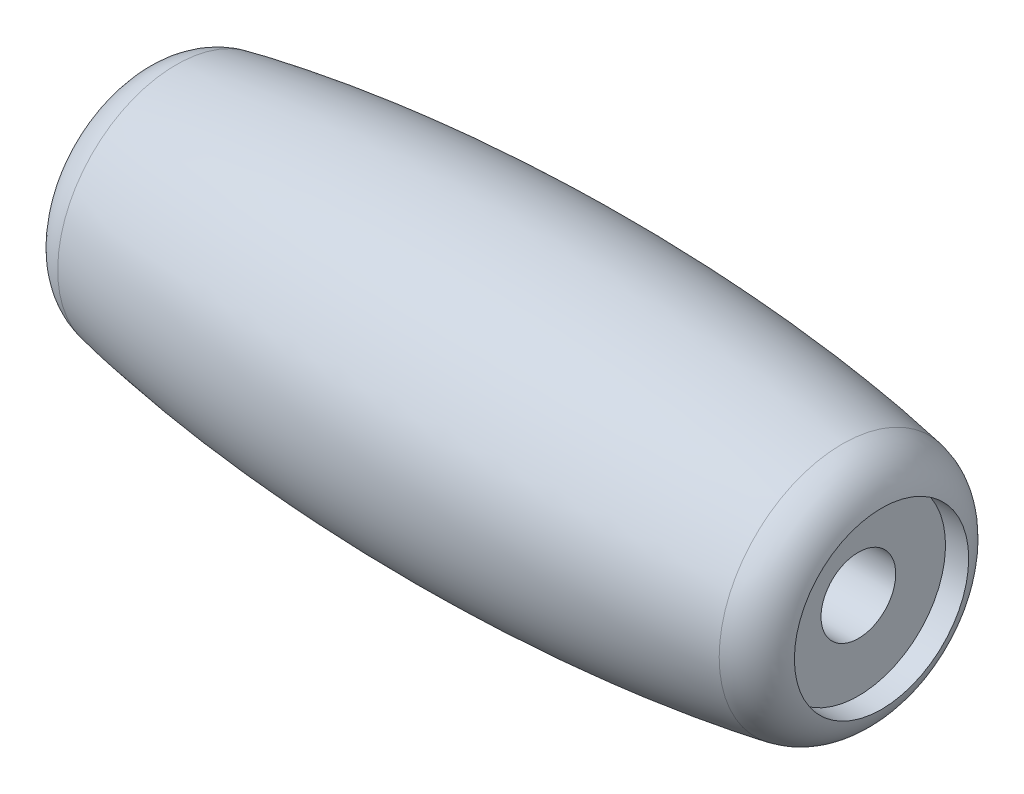
from build123d import *

# Parameters (mm, degrees)
SKETCH2_R          = 1.5
CUT_EXTRUDE1_DEPTH = 32.176914575
SKETCH3_R          = 3.5
SKETCH3_R_2        = 1.5
CUT_EXTRUDE2_DEPTH = 1


with BuildPart() as part:
    # Sketch1 → Revolve5 (revolve)
    with BuildSketch(Plane.XY, mode=Mode.PRIVATE) as revolve5_sk:
        with BuildLine():
            Line((-15.473870067, 0), (14.526129933, 0))
            Line((14.526129933, 0), (14.526129933, 2.977982181))
            ThreePointArc((14.526129933, 2.977982181), (14.061170532, 4.260031462), (12.882479574, 4.945979877))
            add(Edge.make_bspline(
                [(12.882479574, 4.945979877), (-0.755720694, 7.415478586), (-13.871264836, 4.756435317)],
                knots=[0.969017626, 0.969017626, 0.969017626, 2.226302938, 2.226302938, 2.226302938], degree=2, weights=[1, 0.808826436, 1]))
            ThreePointArc((-13.871264836, 4.756435317), (-15.022222343, 4.062253989), (-15.473870067, 2.796313536))
            Line((-15.473870067, 2.796313536), (-15.473870067, 0))
        make_face()
    revolve(revolve5_sk.sketch.rotate(Axis((-15.473870067, 0, 0), (1, 0, 0)), 180), axis=Axis((-15.473870067, 0, 0), (1, 0, 0)))

    # Sketch2 → Cut-Extrude1 (cut, through all)
    with BuildSketch(Plane(origin=(14.526129933, 0, 0), x_dir=(0, 0, -1), z_dir=(1, 0, 0))):
        with Locations(Location((0, 0, 0), (0, 0, 90))):
            Circle(SKETCH2_R)
    extrude(amount=-CUT_EXTRUDE1_DEPTH, mode=Mode.SUBTRACT)

    # Sketch3 → Cut-Extrude2 (cut)
    with BuildSketch(Plane(origin=(14.526129933, 0, 0), x_dir=(0, 0, -1), z_dir=(1, 0, 0))):
        with Locations(Location((0, 0, 0), (0, 0, 90))):
            Circle(SKETCH3_R)
        with Locations(Location((0, 0, 0), (0, 0, 90))):
            Circle(SKETCH3_R_2, mode=Mode.SUBTRACT)
    cut_extrude2 = extrude(amount=-CUT_EXTRUDE2_DEPTH, mode=Mode.SUBTRACT)

    # Mirror1: Cut-Extrude2 across plane
    add(cut_extrude2.mirror(Plane(origin=(-0.473870067, 0, 0), x_dir=(0, 0, 1), z_dir=(1, 0, 0))), mode=Mode.SUBTRACT)


solid = part.part
